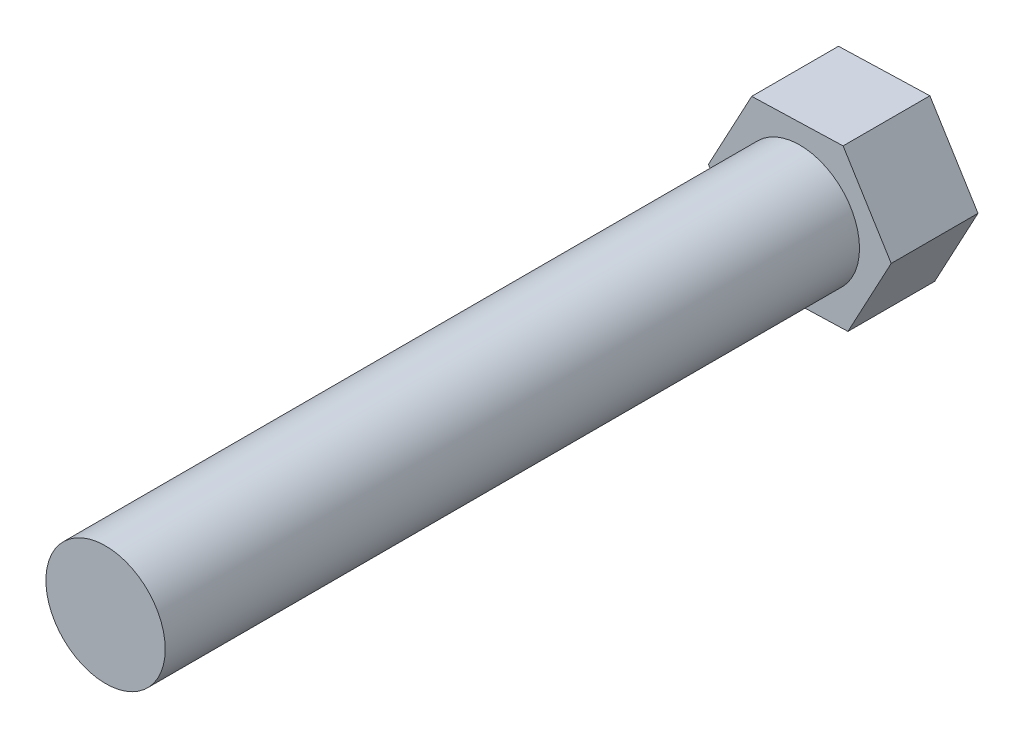
from build123d import *

# Parameters (mm, degrees)
SKETCH1_R           = 2.75
BOSS_EXTRUDE1_DEPTH = 32
BOSS_EXTRUDE2_DEPTH = 4


with BuildPart() as part:
    # Sketch1 → Boss-Extrude1 (new body)
    with BuildSketch(Plane.XY):
        Circle(SKETCH1_R)
    extrude(amount=BOSS_EXTRUDE1_DEPTH)

    # Sketch2 → Boss-Extrude2 (add)
    with BuildSketch(Plane(origin=(0, 0, 0), x_dir=(-1, 0, 0), z_dir=(0, 0, -1))):
        Polygon((1.994220627, -3.712239535), (4.212004056, -0.129074044), (2.217783429, 3.583165492), (-1.994220627, 3.712239535), (-4.212004056, 0.129074044), (-2.217783429, -3.583165492), align=None)
    extrude(amount=BOSS_EXTRUDE2_DEPTH)


solid = part.part
